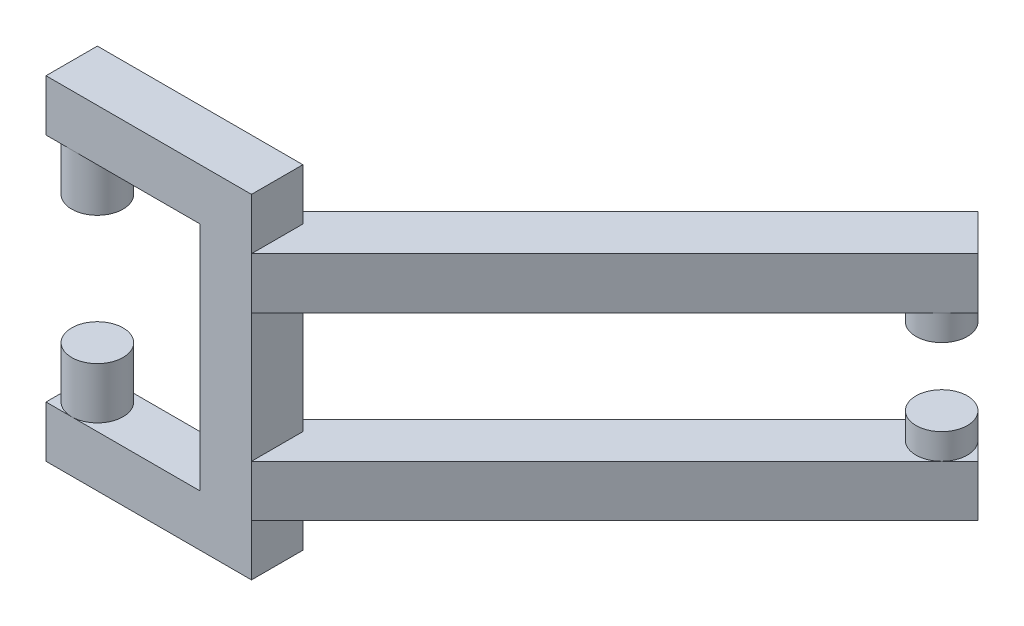
from build123d import *

# Parameters (mm, degrees)
SALIENTE_EXTRUIR1_DEPTH = 10
CROQUIS2_R              = 5
SALIENTE_EXTRUIR4_DEPTH = 10
SALIENTE_EXTRUIR5_START = 10
CROQUIS4_R              = 5
SALIENTE_EXTRUIR5_DEPTH = 10
SALIENTE_EXTRUIR7_START = -10
SALIENTE_EXTRUIR7_DEPTH = 10
CROQUIS8_R              = 5
SALIENTE_EXTRUIR8_DEPTH = 5
SALIENTE_EXTRUIR9_START = 5
CROQUIS10_R             = 5
SALIENTE_EXTRUIR9_DEPTH = 5


with BuildPart() as part:
    # Croquis1 → Saliente-Extruir1 (new body)
    with BuildSketch(Plane.XY):
        Polygon((0, 0), (40, 0), (40, -65), (0, -65), (0, -55), (30, -55), (30, -10), (0, -10), align=None)
    extrude(amount=SALIENTE_EXTRUIR1_DEPTH)

    # Croquis2 → Saliente-Extruir4 (add)
    with BuildSketch(Plane.XZ.offset(10)):
        with Locations(Location((5, 5, 0), (0, 0, 180))):
            Circle(CROQUIS2_R)
    extrude(amount=SALIENTE_EXTRUIR4_DEPTH)

    # Croquis4 → Saliente-Extruir5 (add)
    with BuildSketch(Plane(origin=(0, -55, 0), x_dir=(1, 0, 0), z_dir=(0, 1, 0)).offset(SALIENTE_EXTRUIR5_START)):
        with Locations(Location((5, -5, 0), (0, 0, 180))):
            Circle(CROQUIS4_R)
    extrude(amount=-SALIENTE_EXTRUIR5_DEPTH)

    # Croquis7 → Saliente-Extruir7 (add)
    with BuildSketch(Plane(origin=(0, 0, 0), x_dir=(1, 0, 0), z_dir=(0, 1, 0)).offset(SALIENTE_EXTRUIR7_START)):
        Polygon((30, -5.857864376), (103.639610307, 67.781745931), (110.710678119, 60.710678119), (40, -10), (30, -10), align=None)
    saliente_extruir7 = extrude(amount=-SALIENTE_EXTRUIR7_DEPTH)

    # Simetría1: Saliente-Extruir7 across plane
    add(saliente_extruir7.mirror(Plane.ZX.offset(-32.5)))

    # Croquis8 → Saliente-Extruir8 (add)
    with BuildSketch(Plane.XZ.offset(20)):
        with Locations(Location((103.639610307, -60.710678119, 0), (0, 0, 45))):
            Circle(CROQUIS8_R)
    extrude(amount=SALIENTE_EXTRUIR8_DEPTH)

    # Croquis10 → Saliente-Extruir9 (add)
    with BuildSketch(Plane(origin=(0, -45, 0), x_dir=(1, 0, 0), z_dir=(0, 1, 0)).offset(SALIENTE_EXTRUIR9_START)):
        with Locations(Location((103.639610307, 60.710678119, 0), (0, 0, 315))):
            Circle(CROQUIS10_R)
    extrude(amount=-SALIENTE_EXTRUIR9_DEPTH)


solid = part.part
